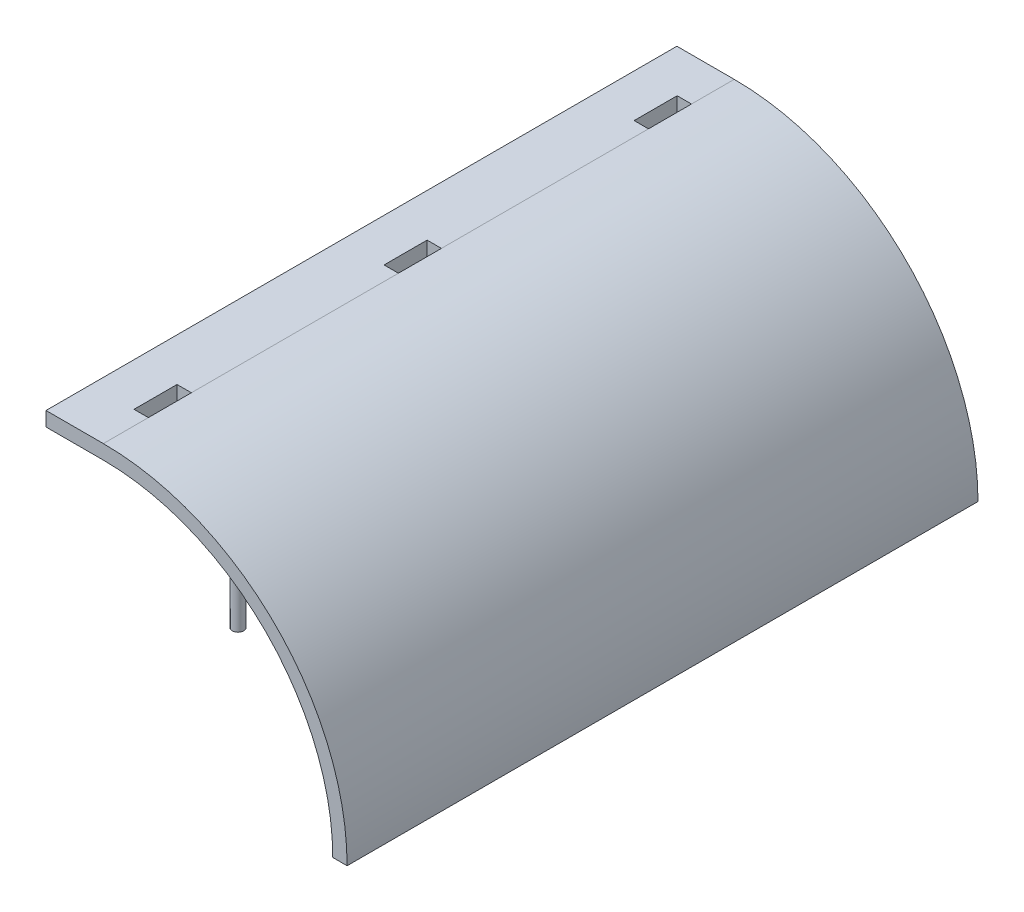
from build123d import *

# Parameters (mm, degrees)
BOSS_EXTRUDE1_DEPTH = 139.7
SKETCH3_W           = 139.7
SKETCH3_H           = 3.175
BOSS_EXTRUDE2_DEPTH = 3.175
SKETCH4_W           = 3.175
SKETCH4_H           = 9.525
CUT_EXTRUDE1_DEPTH  = 162.644610179
LPATTERN1_COUNT     = 3
LPATTERN1_PITCH     = 55.372
SKETCH5_R           = 1.27
BOSS_EXTRUDE3_DEPTH = 25.4
CUT_EXTRUDE2_DEPTH  = 163.670343529


with BuildPart() as part:
    # Sketch2 → Boss-Extrude1 (new body)
    with BuildSketch(Plane.XY):
        with BuildLine():
            Line((-50.8, 50.8), (-60.325, 50.8))
            Line((-60.325, 50.8), (-60.325, 53.975))
            Line((-60.325, 53.975), (-50.8, 53.975))
            ThreePointArc((-50.8, 53.975), (-12.633911485, 38.166088515), (3.175, 0))
            Line((3.175, 0), (0, 0))
            ThreePointArc((0, 0), (-14.878975516, 35.921024484), (-50.8, 50.8))
        make_face()
    extrude(amount=BOSS_EXTRUDE1_DEPTH)

    # Sketch3 → Boss-Extrude2 (add)
    with BuildSketch(Plane.ZY.offset(60.325)):
        with Locations((69.85, 52.3875)):
            Rectangle(SKETCH3_W, SKETCH3_H)
    extrude(amount=BOSS_EXTRUDE2_DEPTH)

    # Sketch4 → Cut-Extrude1 (cut, through all)
    with BuildSketch(Plane.XZ.offset(-50.8)):
        with Locations((-52.3875, 124.971707481)):
            Rectangle(SKETCH4_W, SKETCH4_H)
    cut_extrude1 = extrude(amount=-CUT_EXTRUDE1_DEPTH, mode=Mode.SUBTRACT)

    # LPattern1: Cut-Extrude1 ×3
    with Locations(*[(0, 0, -i * LPATTERN1_PITCH) for i in range(1, LPATTERN1_COUNT)]):
        add(cut_extrude1, mode=Mode.SUBTRACT)

    # Sketch5 → Boss-Extrude3 (add)
    with BuildSketch(Plane(origin=(0, 53.975, 0), x_dir=(1, 0, 0), z_dir=(0, 1, 0))):
        with Locations(Location((-25.4, -4.7625, 0), (0, 0, 270))):
            Circle(SKETCH5_R)
        with Locations(Location((-26.00240478, -134.669690924, 0), (0, 0, 270))):
            Circle(SKETCH5_R)
    extrude(amount=-BOSS_EXTRUDE3_DEPTH)

    # Sketch6 → Cut-Extrude2 (cut, through all)
    with BuildSketch(Plane.XY.offset(139.7)):
        with BuildLine():
            ThreePointArc((-50.8, 53.975), (-12.633911485, 38.166088515), (3.175, 0))
            ThreePointArc((3.175, 0), (10.303147702, 61.103147702), (-50.8, 53.975))
        make_face()
    extrude(amount=-CUT_EXTRUDE2_DEPTH, mode=Mode.SUBTRACT)


solid = part.part
